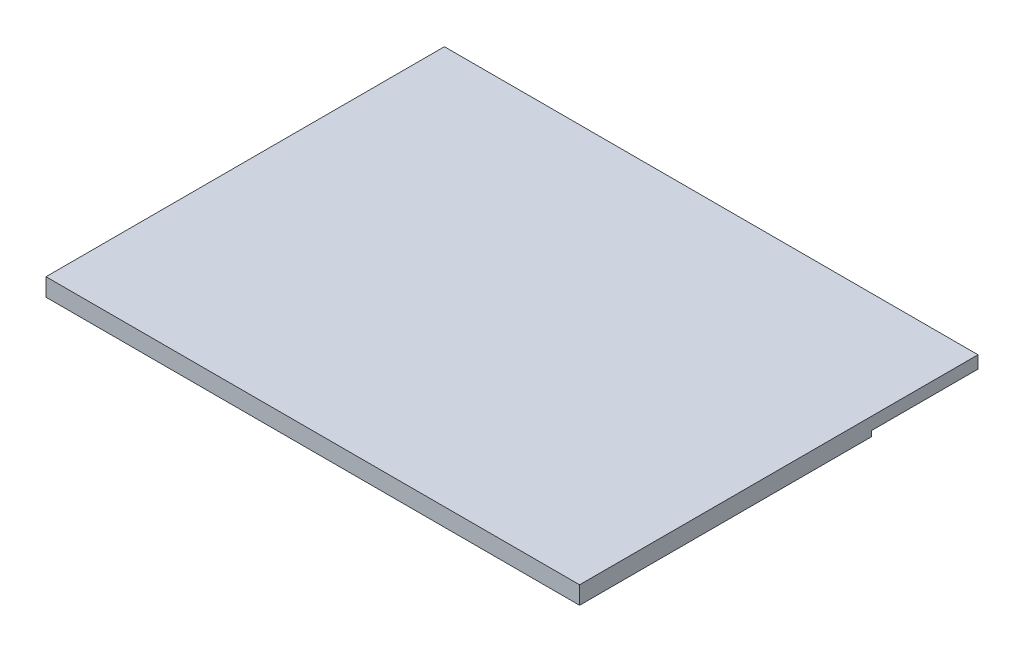
from build123d import *

# Parameters (mm, degrees)
SKETCH1_W             = 5
SKETCH1_H             = 112
BOSS_EXTRUDE1_DEPTH   = 5
SKETCH2_W             = 112
SKETCH2_H             = 5
BOSS_EXTRUDE2_DEPTH   = 145
BOSS_EXTRUDE3_DEPTH   = 107
SKETCH5_W             = 150
SKETCH5_H             = 3
CUT_EXTRUDE1_DEPTH    = 30
CHAMFER1_SIZE         = 2
CHAMFER1_SIZE2        = 1.414213562
CHAMFER1_EDGE_2_SIZE  = 2
CHAMFER1_EDGE_2_SIZE2 = 1.414213562
SKETCH6_W             = 131.302943726
SKETCH6_H             = 15
BOSS_EXTRUDE4_DEPTH   = 2
CUT_EXTRUDE2_DEPTH    = 131.302943725


with BuildPart() as part:
    # Sketch1 → Boss-Extrude1 (new body)
    with BuildSketch(Plane(origin=(0, 0, 0), x_dir=(1, 0, 0), z_dir=(0, 1, 0))):
        Rectangle(SKETCH1_W, SKETCH1_H)
    extrude(amount=BOSS_EXTRUDE1_DEPTH)

    # Sketch2 → Boss-Extrude2 (add)
    with BuildSketch(Plane(origin=(2.5, 0, 0), x_dir=(0, 0, -1), z_dir=(1, 0, 0))):
        with Locations((0, 2.5)):
            Rectangle(SKETCH2_W, SKETCH2_H)
    extrude(amount=BOSS_EXTRUDE2_DEPTH)

    # Sketch3 → Boss-Extrude3 (add)
    with BuildSketch(Plane(origin=(0, 0, -56), x_dir=(-1, 0, 0), z_dir=(0, 0, -1))):
        Polygon((-136.651471863, 0), (-141.251471863, -4.6), (-3.748528137, -4.6), (-8.348528137, 0), align=None)
    extrude(amount=-BOSS_EXTRUDE3_DEPTH)

    # Sketch5 → Cut-Extrude1 (cut)
    with BuildSketch(Plane(origin=(0, 0, -56), x_dir=(-1, 0, 0), z_dir=(0, 0, -1))):
        with Locations((-72.5, 0)):
            Rectangle(SKETCH5_W, SKETCH5_H)
    extrude(amount=-CUT_EXTRUDE1_DEPTH, mode=Mode.SUBTRACT)

    # Chamfer1
    chamfer1_edges = [part.edges().sort_by_distance(p)[0] for p in [
        (3.748528137, -4.6, -2.5),
    ]]
    chamfer1_side = [part.faces().sort_by_distance(p)[0] for p in [
        (72.5, -4.6, -2.5),
    ]]
    chamfer(chamfer1_edges, length=CHAMFER1_SIZE, length2=CHAMFER1_SIZE2, reference=chamfer1_side[0])

    # Chamfer1 edge 2
    chamfer1_edge_2_edges = [part.edges().sort_by_distance(p)[0] for p in [
        (141.251471863, -4.6, -2.5),
    ]]
    chamfer1_edge_2_side = [part.faces().sort_by_distance(p)[0] for p in [
        (72.5, -4.6, -2.5),
    ]]
    chamfer(chamfer1_edge_2_edges, length=CHAMFER1_EDGE_2_SIZE, length2=CHAMFER1_EDGE_2_SIZE2, reference=chamfer1_edge_2_side[0])

    # Sketch6 → Boss-Extrude4 (add)
    with BuildSketch(Plane.XZ.offset(4.6)):
        with Locations((72.5, -43.3)):
            Rectangle(SKETCH6_W, SKETCH6_H)
    extrude(amount=BOSS_EXTRUDE4_DEPTH)

    # Sketch7 → Cut-Extrude2 (cut)
    with BuildSketch(Plane(origin=(138.151471863, 0, 0), x_dir=(0, 0, -1), z_dir=(1, 0, 0))):
        Polygon((35.8, -4.6), (52.8358392, -6.6), (35.8, -6.6), align=None)
    extrude(amount=-CUT_EXTRUDE2_DEPTH, mode=Mode.SUBTRACT)


solid = part.part
